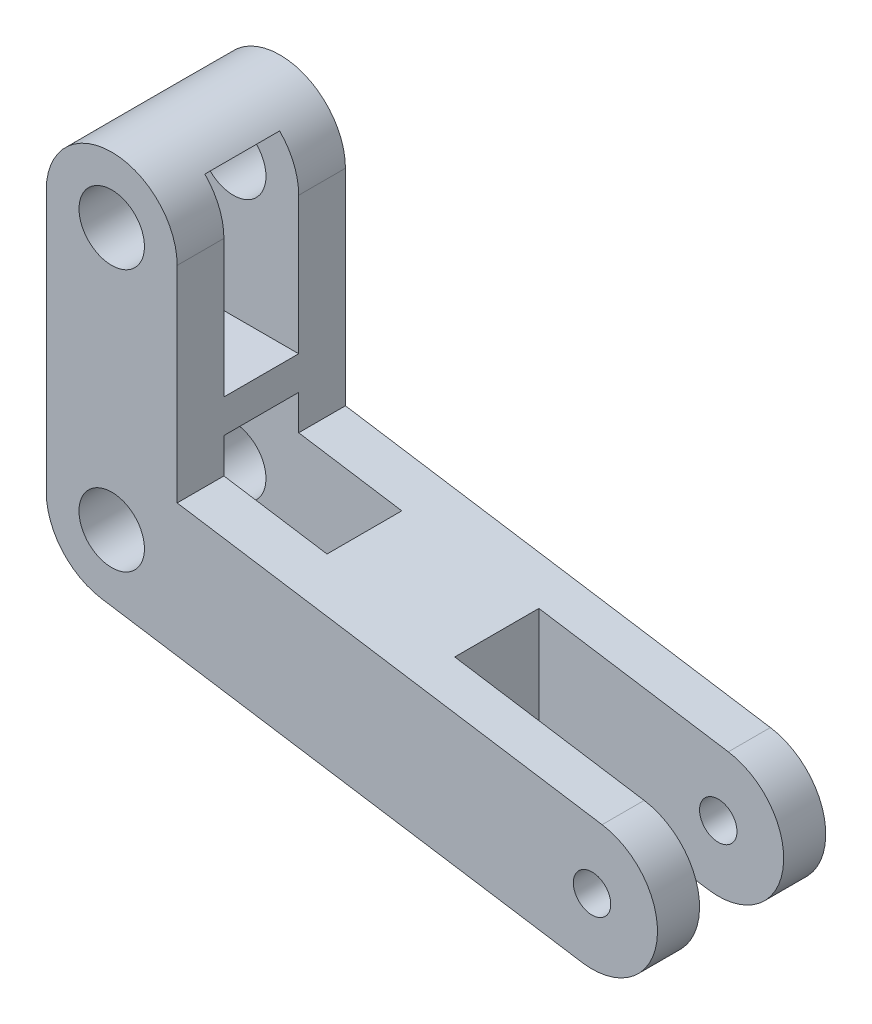
from build123d import *

# Parameters (mm, degrees)
SKETCH_1_R          = 1.75
SKETCH_1_R_2        = 1
EXTRUDE_1_DEPTH     = 4.5
SKETCH_5_W          = 9.199682462
SKETCH_5_H          = 9.813167506
SKETCH_5_W_2        = 14.660354758
SKETCH_5_H_2        = 10.525453646
CUT_EXTRUDE_3_DEPTH = 2
SKETCH_6_W          = 19.186818514
SKETCH_6_H          = 12
CUT_EXTRUDE_4_DEPTH = 2.25


with BuildPart() as part:
    # 草图1 → 凸台-拉伸1 (new, symmetric)
    with BuildSketch(Plane.XY):
        with BuildLine():
            Line((25.152003619, -7.458331848), (-0.538461538, -3.458331848))
            ThreePointArc((-0.538461538, -3.458331848), (-2.658440839, -2.276552725), (-3.5, 0))
            Line((-3.5, 0), (-3.5, 14))
            ThreePointArc((-3.5, 14), (0, 17.5), (3.5, 14))
            Line((3.5, 14), (3.5, 2.997220935))
            Line((3.5, 2.997220935), (26.228926696, -0.541668152))
            ThreePointArc((26.228926696, -0.541668152), (29.148797005, -4.538461538), (25.152003619, -7.458331848))
        make_face()
        Circle(SKETCH_1_R, mode=Mode.SUBTRACT)
        with Locations((0, 14)):
            Circle(SKETCH_1_R, mode=Mode.SUBTRACT)
        with Locations((25.690465157, -4)):
            Circle(SKETCH_1_R_2, mode=Mode.SUBTRACT)
    extrude(amount=EXTRUDE_1_DEPTH, both=True)

    # 草图5 → 切除-拉伸3 (cut, symmetric)
    with BuildSketch(Plane.XY):
        with Locations((-1.099841231, 11.563279791)):
            Rectangle(SKETCH_5_W, SKETCH_5_H)
        with Locations((1.684655549, -0.393377614)):
            Rectangle(SKETCH_5_W_2, SKETCH_5_H_2)
    extrude(amount=CUT_EXTRUDE_3_DEPTH, both=True, mode=Mode.SUBTRACT)

    # 草图6 → 切除-拉伸4 (cut, symmetric)
    with BuildSketch(Plane.XY):
        with Locations((25.690465157, -4)):
            Rectangle(SKETCH_6_W, SKETCH_6_H)
    extrude(amount=CUT_EXTRUDE_4_DEPTH, both=True, mode=Mode.SUBTRACT)


solid = part.part
